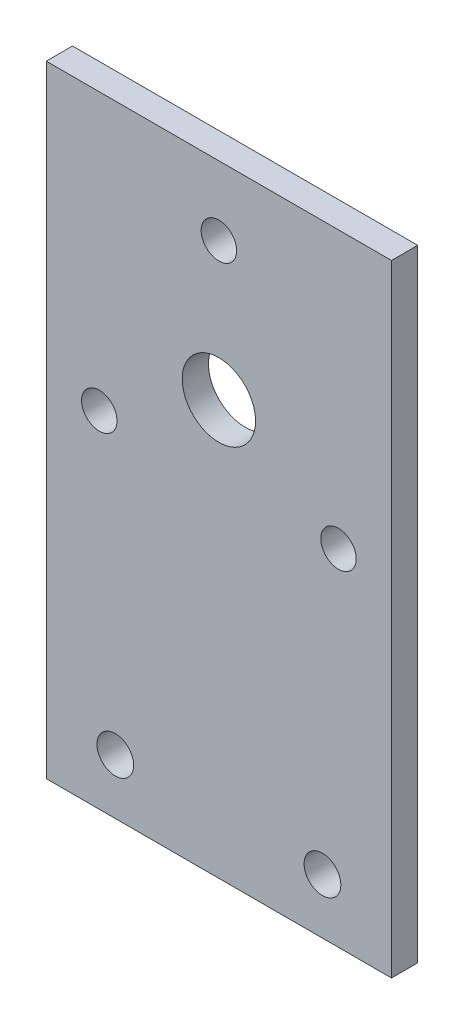
from build123d import *

# Parameters (mm, degrees)
SKETCH1_W                        = 63.5
SKETCH1_H                        = 114.3
BOSS_EXTRUDE1_DEPTH              = 4.826
F_0_257_DIAMETER_HOLE2_D         = 6.7564
F_0_257_DIAMETER_HOLE5_D         = 6.5278
F_17_32_0_53125_DIAMETER_HOLE1_D = 13.49375


with BuildPart() as part:
    # Sketch1 → Boss-Extrude1 (new body)
    with BuildSketch(Plane.XY):
        with Locations((31.75, 57.15)):
            Rectangle(SKETCH1_W, SKETCH1_H)
    extrude(amount=-BOSS_EXTRUDE1_DEPTH)

    # F (0.257) Diameter Hole2 (through all)
    with Locations(Plane.XY):
        with Locations((12.7, 10.16), (50.8, 10.16)):
            Hole(F_0_257_DIAMETER_HOLE2_D / 2)

    # F (0.257) Diameter Hole5 (through all)
    with Locations(Plane.XY):
        with Locations((31.75, 101.6), (9.7536, 63.5), (53.7464, 63.5)):
            Hole(F_0_257_DIAMETER_HOLE5_D / 2)

    # 17/32 (0.53125) Diameter Hole1 (through all)
    with Locations(Plane.XY):
        with Locations((31.75, 76.2)):
            Hole(F_17_32_0_53125_DIAMETER_HOLE1_D / 2)


solid = part.part
